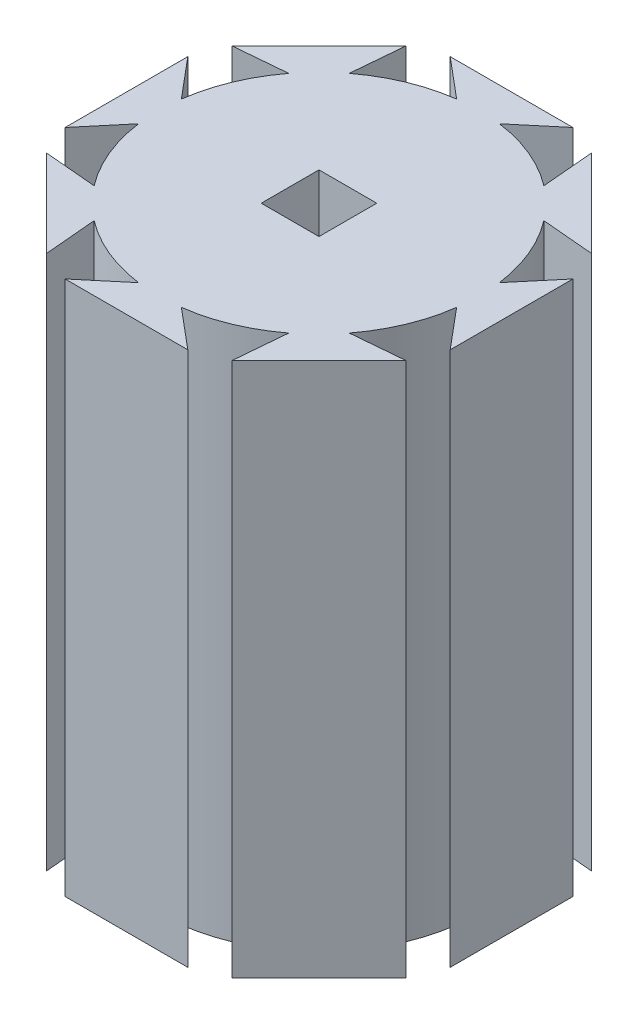
from build123d import *

# Parameters (mm, degrees)
SKETCH2_R           = 19.05
SKETCH2_W           = 6.858
SKETCH2_H           = 6.858
BOSS_EXTRUDE1_DEPTH = 63.5
BOSS_EXTRUDE2_DEPTH = 63.5
CIRPATTERN1_COUNT   = 8


with BuildPart() as part:
    # Sketch2 → Boss-Extrude1 (new body)
    with BuildSketch(Plane(origin=(0, 0, 0), x_dir=(1, 0, 0), z_dir=(0, 1, 0))):
        with Locations(Location((0, 0, 0), (0, 0, 270))):
            Circle(SKETCH2_R)
        Rectangle(SKETCH2_W, SKETCH2_H, mode=Mode.SUBTRACT)
    extrude(amount=BOSS_EXTRUDE1_DEPTH)

    # Sketch3 → Boss-Extrude2 (add)
    with BuildSketch(Plane(origin=(0, 0, 0), x_dir=(1, 0, 0), z_dir=(0, 1, 0))):
        with BuildLine():
            Line((0, 22.86), (0, 19.05))
            ThreePointArc((0, 19.05), (1.272844406, 19.007429261), (2.54, 18.879907309))
            Line((2.54, 18.879907309), (7.283289763, 22.86))
            Line((7.283289763, 22.86), (0, 22.86))
        make_face()
        with BuildLine():
            ThreePointArc((-2.54, 18.879907309), (-1.272844406, 19.007429261), (0, 19.05))
            Line((0, 19.05), (0, 22.86))
            Line((0, 22.86), (-7.283289763, 22.86))
            Line((-7.283289763, 22.86), (-2.54, 18.879907309))
        make_face()
    boss_extrude2 = extrude(amount=BOSS_EXTRUDE2_DEPTH)

    # CirPattern1: Boss-Extrude2 ×8 about axis
    cirpattern1_axis = Axis((0, 0, 0), (0, 1, 0))
    for i in range(1, CIRPATTERN1_COUNT):
        add(boss_extrude2.rotate(cirpattern1_axis, i * 360 / CIRPATTERN1_COUNT))


solid = part.part
